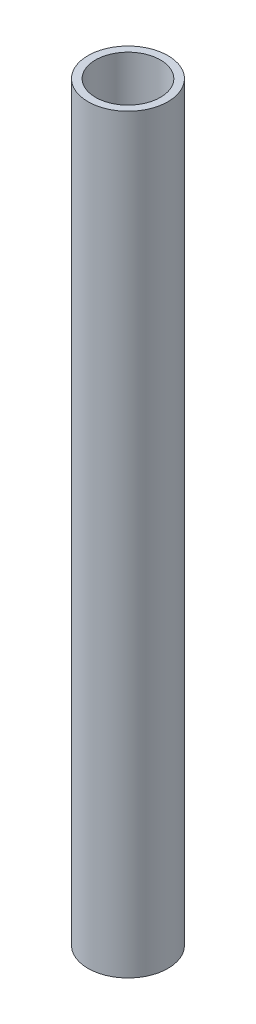
from build123d import *

# Parameters (mm, degrees)
SKETCH_1_R      = 10.65
SKETCH_1_R_2    = 8.65
EXTRUDE_1_DEPTH = 200


with BuildPart() as part:
    # Эскиз1 → Бобышка-Вытянуть1 (new body)
    with BuildSketch(Plane(origin=(0, 0, 0), x_dir=(1, 0, 0), z_dir=(0, 1, 0))):
        with Locations(Location((0, -1.5, 0), (0, 0, 270))):
            Circle(SKETCH_1_R)
        with Locations(Location((0, -1.5, 0), (0, 0, 270))):
            Circle(SKETCH_1_R_2, mode=Mode.SUBTRACT)
    extrude(amount=EXTRUDE_1_DEPTH)


solid = part.part
